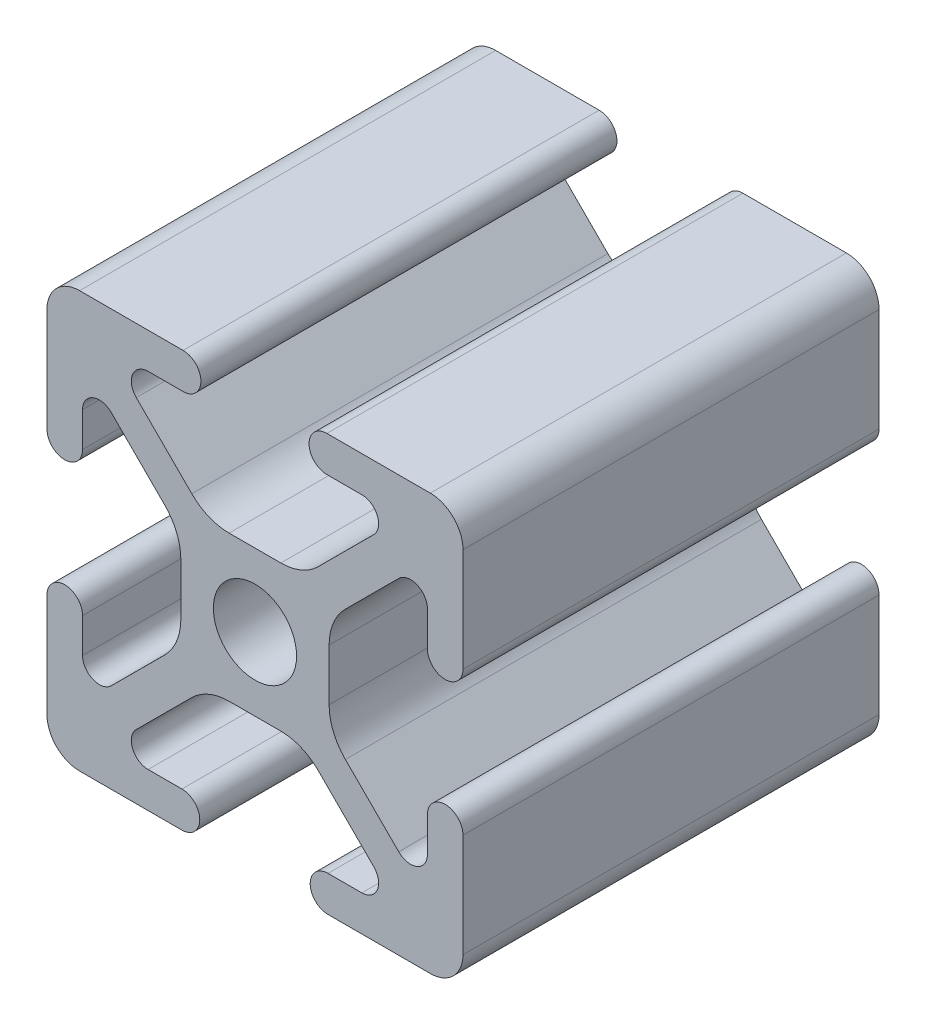
from build123d import *

# Parameters (mm, degrees)
SKETCH1_R           = 2.5
BOSS_EXTRUDE1_DEPTH = 25


with BuildPart() as part:
    # Sketch1 → Boss-Extrude1 (new body)
    with BuildSketch(Plane(origin=(0, 0, -4000), x_dir=(-1, 0, 0), z_dir=(0, 0, -1))):
        with BuildLine():
            Line((12.5, 4.32), (12.5, 10.537068835))
            ThreePointArc((12.5, 10.537068835), (11.925070773, 11.925070773), (10.537068835, 12.5))
            Line((10.537068835, 12.5), (4.32, 12.5))
            ThreePointArc((4.32, 12.5), (3.25, 11.43), (4.32, 10.36))
            Line((4.32, 10.36), (6.42, 10.36))
            ThreePointArc((6.42, 10.36), (7.35325999, 9.736168088), (7.133653911, 8.635298598))
            Line((7.133653911, 8.635298598), (3.795290766, 5.301828272))
            ThreePointArc((3.795290766, 5.301828272), (2.76743922, 4.61585726), (1.555406707, 4.375))
            Line((1.555406707, 4.375), (-1.555406707, 4.375))
            ThreePointArc((-1.555406707, 4.375), (-2.76743922, 4.61585726), (-3.795290766, 5.301828272))
            Line((-3.795290766, 5.301828272), (-7.133653912, 8.635298598))
            ThreePointArc((-7.133653912, 8.635298598), (-7.35325999, 9.736168088), (-6.42, 10.36))
            Line((-6.42, 10.36), (-4.32, 10.36))
            ThreePointArc((-4.32, 10.36), (-3.25, 11.43), (-4.32, 12.5))
            Line((-4.32, 12.5), (-10.537068835, 12.5))
            ThreePointArc((-10.537068835, 12.5), (-11.925070773, 11.925070773), (-12.5, 10.537068835))
            Line((-12.5, 10.537068835), (-12.5, 4.32))
            ThreePointArc((-12.5, 4.32), (-11.43, 3.25), (-10.36, 4.32))
            Line((-10.36, 4.32), (-10.36, 6.396886949))
            ThreePointArc((-10.36, 6.396886949), (-9.736852394, 7.329863489), (-8.636346088, 7.111588351))
            Line((-8.636346088, 7.111588351), (-5.432204773, 3.912143135))
            ThreePointArc((-5.432204773, 3.912143135), (-4.708985779, 2.831057106), (-4.455, 1.555406707))
            Line((-4.455, 1.555406707), (-4.455, -1.555406707))
            ThreePointArc((-4.455, -1.555406707), (-4.708985779, -2.831057106), (-5.432204773, -3.912143135))
            Line((-5.432204773, -3.912143135), (-8.636346088, -7.111588351))
            ThreePointArc((-8.636346088, -7.111588351), (-9.736852394, -7.329863489), (-10.36, -6.396886949))
            Line((-10.36, -6.396886949), (-10.36, -4.32))
            ThreePointArc((-10.36, -4.32), (-11.43, -3.25), (-12.5, -4.32))
            Line((-12.5, -4.32), (-12.5, -10.537068835))
            ThreePointArc((-12.5, -10.537068835), (-11.925070773, -11.925070773), (-10.537068835, -12.5))
            Line((-10.537068835, -12.5), (-4.387856959, -12.5))
            ThreePointArc((-4.387856959, -12.5), (-3.317856959, -11.43), (-4.387856959, -10.36))
            Line((-4.387856959, -10.36), (-6.42, -10.36))
            ThreePointArc((-6.42, -10.36), (-7.35325999, -9.736168088), (-7.133653912, -8.635298598))
            Line((-7.133653912, -8.635298598), (-3.795290766, -5.301828272))
            ThreePointArc((-3.795290766, -5.301828272), (-2.76743922, -4.61585726), (-1.555406707, -4.375))
            Line((-1.555406707, -4.375), (1.555406707, -4.375))
            ThreePointArc((1.555406707, -4.375), (2.76743922, -4.61585726), (3.795290766, -5.301828272))
            Line((3.795290766, -5.301828272), (7.133653912, -8.635298598))
            ThreePointArc((7.133653912, -8.635298598), (7.35325999, -9.736168088), (6.42, -10.36))
            Line((6.42, -10.36), (4.387856959, -10.36))
            ThreePointArc((4.387856959, -10.36), (3.317856959, -11.43), (4.387856959, -12.5))
            Line((4.387856959, -12.5), (10.537068835, -12.5))
            ThreePointArc((10.537068835, -12.5), (11.925070773, -11.925070773), (12.5, -10.537068835))
            Line((12.5, -10.537068835), (12.5, -4.32))
            ThreePointArc((12.5, -4.32), (11.43, -3.25), (10.36, -4.32))
            Line((10.36, -4.32), (10.36, -6.396886949))
            ThreePointArc((10.36, -6.396886949), (9.736852394, -7.329863489), (8.636346088, -7.111588351))
            Line((8.636346088, -7.111588351), (5.432204773, -3.912143135))
            ThreePointArc((5.432204773, -3.912143135), (4.708985779, -2.831057106), (4.455, -1.555406707))
            Line((4.455, -1.555406707), (4.455, 1.555406707))
            ThreePointArc((4.455, 1.555406707), (4.708985779, 2.831057106), (5.432204773, 3.912143135))
            Line((5.432204773, 3.912143135), (8.636346088, 7.111588351))
            ThreePointArc((8.636346088, 7.111588351), (9.736852394, 7.329863489), (10.36, 6.396886949))
            Line((10.36, 6.396886949), (10.36, 4.32))
            ThreePointArc((10.36, 4.32), (11.43, 3.25), (12.5, 4.32))
        make_face()
        with Locations(Location((0, 0, 0), (0, 0, 180))):
            Circle(SKETCH1_R, mode=Mode.SUBTRACT)
    extrude(amount=-BOSS_EXTRUDE1_DEPTH)


solid = part.part
